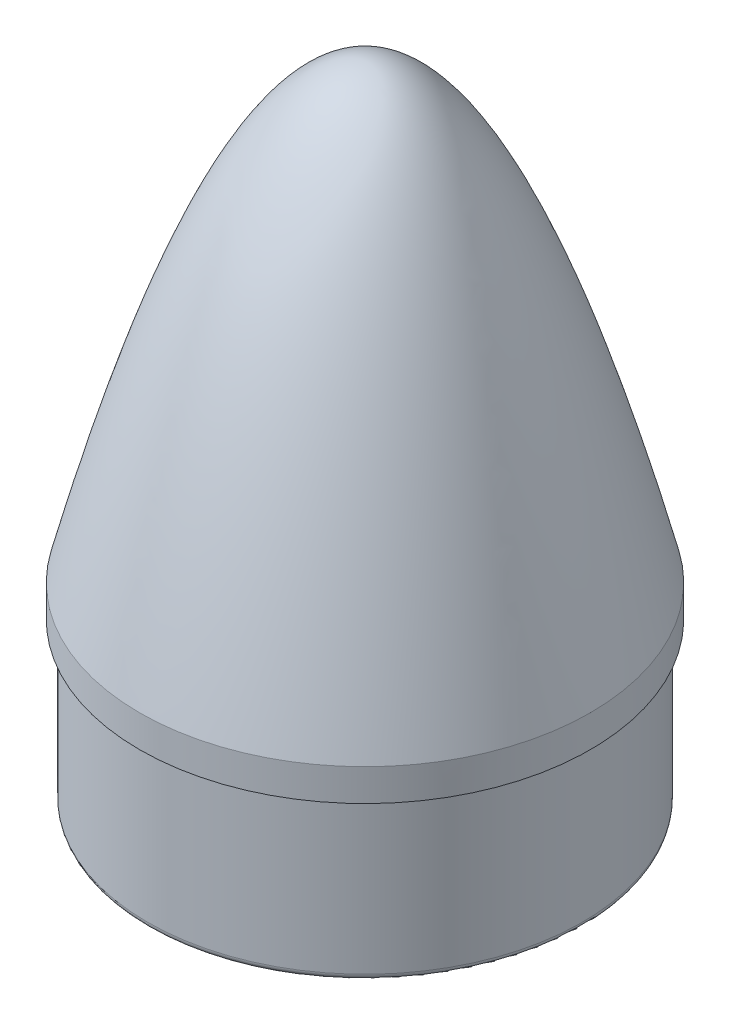
from build123d import *


with BuildPart() as part:
    # Schizzo1 → Rivoluzione3 (revolve)
    with BuildSketch(Plane.XY, mode=Mode.PRIVATE) as rivoluzione3_sk:
        with BuildLine():
            Line((0, 141), (0, 0))
            Line((0, 0), (0, -10))
            Line((0, -10), (0, -60.000000094))
            Line((0, -60.000000094), (66, -60.000000094))
            ThreePointArc((66, -60.000000094), (67.414213562, -59.414213657), (68, -58.000000094))
            Line((68, -58.000000094), (68, -10.000000094))
            Line((68, -10.000000094), (70.499999813, -10.000000094))
            Line((70.499999813, -10.000000094), (70.499999813, -9.4e-08))
            add(Edge.make_bspline(
                [(0, 141), (35.25, 140.999999953), (70.499999813, -9.4e-08)],
                knots=[0.08657946, 0.08657946, 0.08657946, 0.952374057, 0.952374057, 0.952374057], degree=2))
        make_face()
    revolve(rivoluzione3_sk.sketch.rotate(Axis((0, 141, 0), (0, -1, 0)), 90), axis=Axis((0, 141, 0), (0, -1, 0)))


solid = part.part
